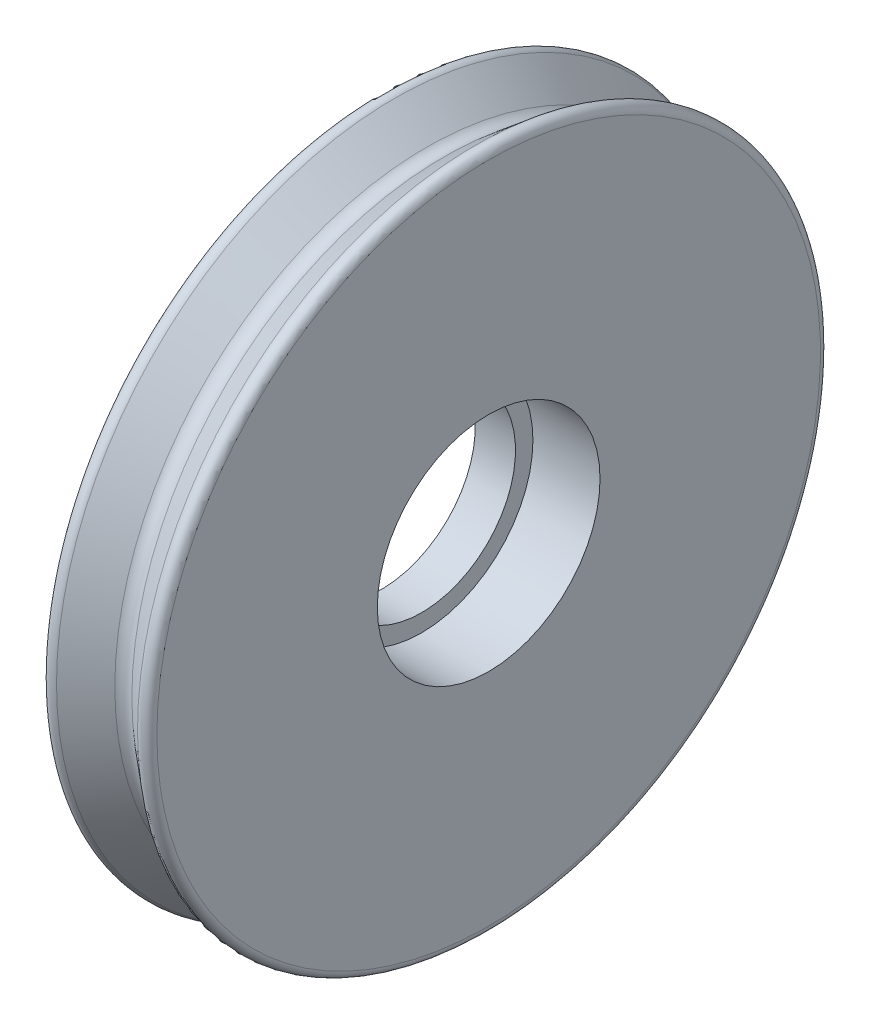
from build123d import *

# Parameters (mm, degrees)
FILLET1_R = 0.3


with BuildPart() as part:
    # Sketch1 → Revolve1 (revolve)
    with BuildSketch(Plane.XY, mode=Mode.PRIVATE) as revolve1_sk:
        with BuildLine():
            Line((0, 3.5), (0, 13))
            Line((0, 13), (1.682055053, 11.614110106))
            ThreePointArc((1.682055053, 11.614110106), (2, 11.5), (2.317944947, 11.614110106))
            Line((2.317944947, 11.614110106), (4, 13))
            Line((4, 13), (4, 4.15))
            Line((4, 4.15), (1.5, 4.15))
            Line((1.5, 4.15), (1.5, 3.5))
            Line((1.5, 3.5), (0, 3.5))
        make_face()
    revolve(revolve1_sk.sketch.rotate(Axis((0, 0, 0), (1, 0, 0)), 90), axis=Axis((0, 0, 0), (1, 0, 0)))

    # Fillet1
    fillet1_edges = [part.edges().sort_by_distance(p)[0] for p in [
        (0, 0, -13),
        (4, 0, -13),
    ]]
    fillet(fillet1_edges, radius=FILLET1_R)


solid = part.part
